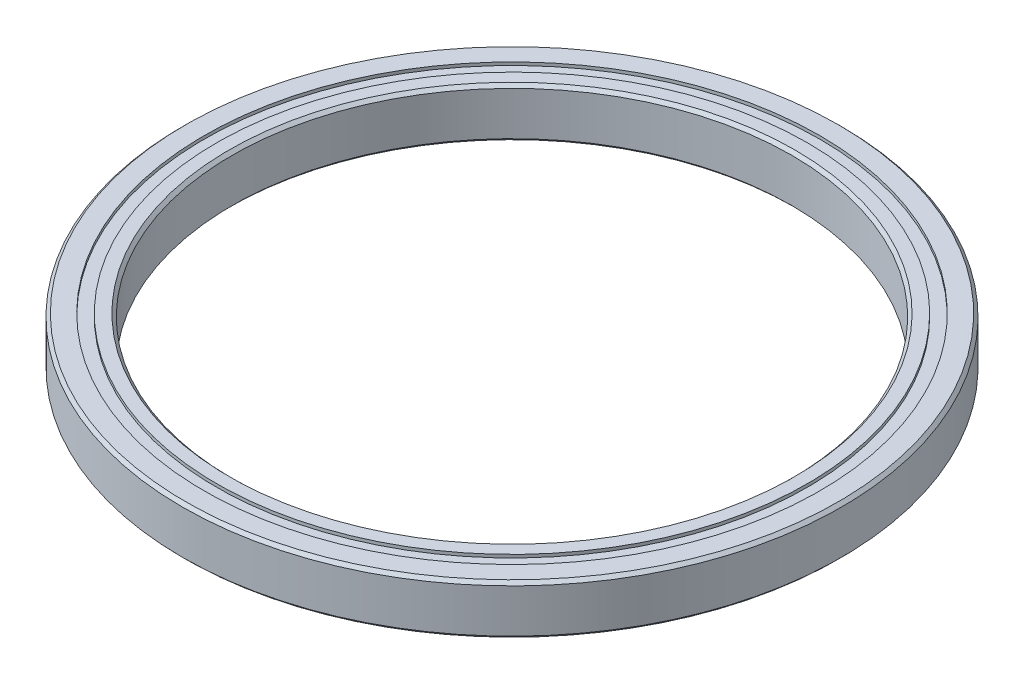
from build123d import *


with BuildPart() as part:
    # 草图1 → 旋转1 (revolve)
    with BuildSketch(Plane.XY, mode=Mode.PRIVATE) as revolve_1_sk:
        Polygon((-45.5, 0), (-47.5, 0), (-47.5, 0.5), (-49.5, 0.5), (-49.5, 0), (-52.5, 0), (-53, 0.5), (-53, 7.5), (-52.5, 8), (-49.5, 8), (-49.5, 7.5), (-47.5, 7.5), (-47.5, 8), (-45.5, 8), (-45, 7.5), (-45, 0.5), align=None)
    revolve(revolve_1_sk.sketch.rotate(Axis((0, 0, 0), (0, 1, 0)), 270), axis=Axis((0, 0, 0), (0, 1, 0)))


solid = part.part
